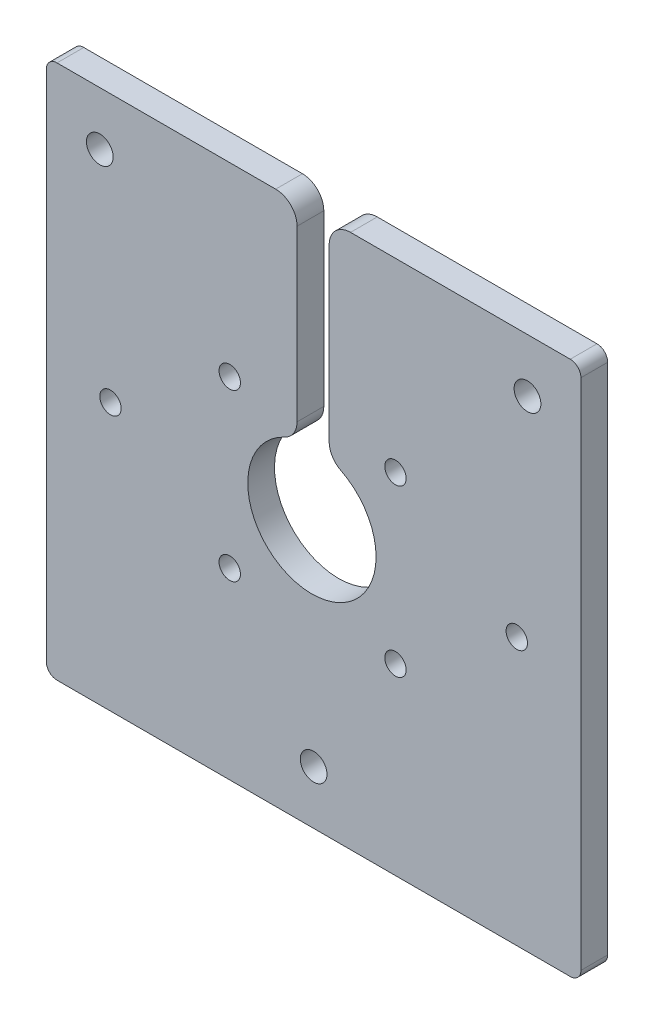
from build123d import *

# Parameters (mm, degrees)
SKETCH1_R           = 2
SKETCH1_R_2         = 2.5
BOSS_EXTRUDE1_DEPTH = 5


with BuildPart() as part:
    # Sketch1 → Boss-Extrude1 (new body)
    with BuildSketch(Plane(origin=(0, 0, 701.677889561), x_dir=(-1, 0, 0), z_dir=(0, 0, -1))):
        with BuildLine():
            Line((-99.719780497, 143.525710146), (-99.719780497, 111.833409744))
            ThreePointArc((-99.719780497, 111.833409744), (-99.09450302, 109.686028108), (-97.41415655, 108.210001157))
            ThreePointArc((-97.41415655, 108.210001157), (-102.311705141, 85.341210472), (-107.91415655, 108.047599613))
            ThreePointArc((-107.91415655, 108.047599613), (-106.312252376, 109.521939482), (-105.719780497, 111.616874352))
            Line((-105.719780497, 111.616874352), (-105.719780497, 143.525710146))
            ThreePointArc((-105.719780497, 143.525710146), (-106.891353372, 146.354137271), (-109.719780497, 147.525710146))
            Line((-109.719780497, 147.525710146), (-150.816081745, 147.525710146))
            ThreePointArc((-150.816081745, 147.525710146), (-152.230295307, 146.939923708), (-152.816081745, 145.525710146))
            Line((-152.816081745, 145.525710146), (-152.816081745, 49.525710146))
            ThreePointArc((-152.816081745, 49.525710146), (-152.230295307, 48.111496583), (-150.816081745, 47.525710146))
            Line((-150.816081745, 47.525710146), (-54.816081745, 47.525710146))
            ThreePointArc((-54.816081745, 47.525710146), (-53.401868182, 48.111496583), (-52.816081745, 49.525710146))
            Line((-52.816081745, 49.525710146), (-52.816081745, 145.525710146))
            ThreePointArc((-52.816081745, 145.525710146), (-53.401868182, 146.939923708), (-54.816081745, 147.525710146))
            Line((-54.816081745, 147.525710146), (-95.719780497, 147.525710146))
            ThreePointArc((-95.719780497, 147.525710146), (-98.548207622, 146.354137271), (-99.719780497, 143.525710146))
        make_face()
        with Locations(Location((-87.123479249, 81.839775395, 0), (0, 0, 180))):
            Circle(SKETCH1_R, mode=Mode.SUBTRACT)
        with Locations(Location((-118.123479249, 81.839775395, 0), (0, 0, 180))):
            Circle(SKETCH1_R, mode=Mode.SUBTRACT)
        with Locations(Location((-87.123479249, 112.839775395, 0), (0, 0, 180))):
            Circle(SKETCH1_R, mode=Mode.SUBTRACT)
        with Locations(Location((-118.123479249, 112.839775395, 0), (0, 0, 180))):
            Circle(SKETCH1_R, mode=Mode.SUBTRACT)
        with Locations(Location((-102.816081745, 57.525710146, 0), (0, 0, 180))):
            Circle(SKETCH1_R_2, mode=Mode.SUBTRACT)
        with Locations(Location((-62.816081745, 137.525710146, 0), (0, 0, 180))):
            Circle(SKETCH1_R_2, mode=Mode.SUBTRACT)
        with Locations(Location((-142.816081745, 137.525710146, 0), (0, 0, 180))):
            Circle(SKETCH1_R_2, mode=Mode.SUBTRACT)
        with Locations(Location((-64.816081745, 97.525710146, 0), (0, 0, 180))):
            Circle(SKETCH1_R, mode=Mode.SUBTRACT)
        with Locations(Location((-140.816081745, 97.525710146, 0), (0, 0, 180))):
            Circle(SKETCH1_R, mode=Mode.SUBTRACT)
    extrude(amount=-BOSS_EXTRUDE1_DEPTH)


solid = part.part
